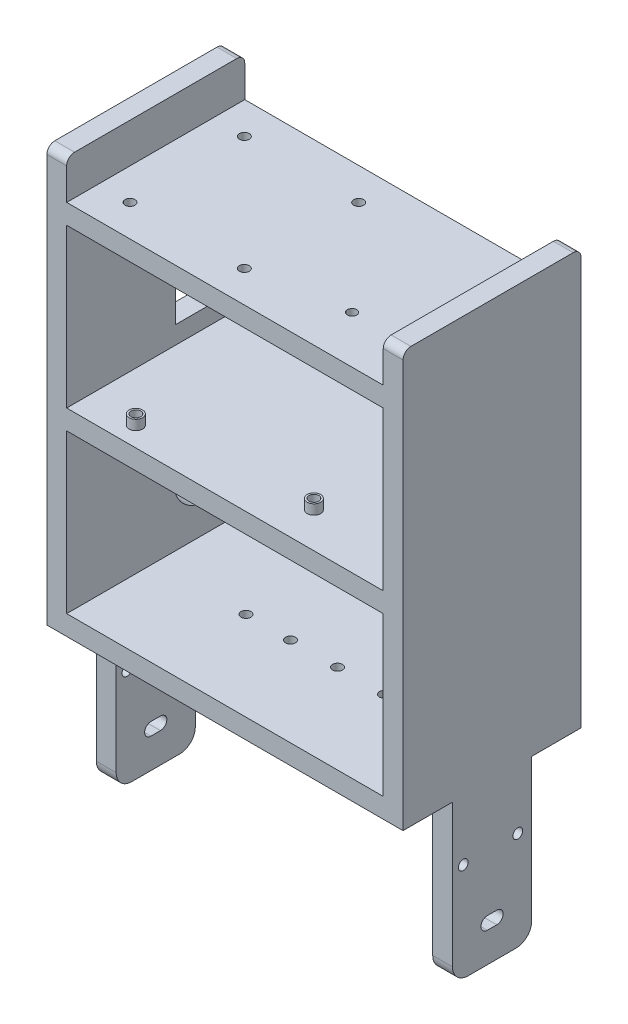
from build123d import *
from build123d.topology import SkipClean

# Parameters (mm, degrees)
SKETCH1_W             = 6.35
SKETCH1_H             = 127
SKETCH1_W_2           = 101.6
SKETCH1_H_2           = 6.35
BOSS_EXTRUDE1_DEPTH   = 57.15
SKETCH2_W             = 25.4
SKETCH2_H             = 50.8
BOSS_EXTRUDE2_DEPTH   = 6.35
BOSS_EXTRUDE3_DEPTH   = 0.508
CUT_EXTRUDE1_DEPTH    = 181.488225001
FILLET1_R             = 5.00126
SKETCH7_R             = 1.5748
CUT_EXTRUDE2_DEPTH    = 181.165514181
CUT_EXTRUDE3_DEPTH    = 6.35
BOSS_EXTRUDE6_START   = 3.81
BOSS_EXTRUDE6_DEPTH   = 3.81
SKETCH10_R            = 1.5875
CUT_EXTRUDE5_DEPTH    = 6.35
SKETCH11_R            = 1.5875
CUT_EXTRUDE6_DEPTH    = 6.35
SKETCH12_R            = 1.49987
CUT_EXTRUDE7_DEPTH    = 6.35
SKETCH13_R            = 1.5875
CUT_EXTRUDE8_DEPTH    = 6.35
SKETCH9_W             = 12.7
SKETCH9_H             = 10.922
CUT_EXTRUDE4_DEPTH    = 6.35
SKETCH10_5_R          = 2.159
SKETCH10_5_R_2        = 1.5875
BOSS_EXTRUDE9_DEPTH   = 3.175
BOSS_EXTRUDE9_2_DEPTH = 3.175
BOSS_EXTRUDE9_3_DEPTH = 3.175
BOSS_EXTRUDE9_4_DEPTH = 3.175
FILLET2_R             = 2.54


with BuildPart() as part:
    # Sketch1 → Boss-Extrude1 (new body)
    with BuildSketch(Plane.XY):
        with Locations((104.775, 63.5)):
            Rectangle(SKETCH1_W, SKETCH1_H)
        with Locations((-3.175, 63.5)):
            Rectangle(SKETCH1_W, SKETCH1_H)
        with Locations((50.8, 111.125)):
            Rectangle(SKETCH1_W_2, SKETCH1_H_2)
        with Locations((50.8, 53.975)):
            Rectangle(SKETCH1_W_2, SKETCH1_H_2)
        Polygon((107.95, -6.35), (101.6, -6.35), (0, -6.35), (-6.35, -6.35), (-6.35, 0), (0, 0), (101.6, 0), (107.95, 0), align=None)
    extrude(amount=-BOSS_EXTRUDE1_DEPTH)

    # Sketch2 → Boss-Extrude2 (add)
    with BuildSketch(Plane(origin=(107.95, 0, 0), x_dir=(0, 0, -1), z_dir=(1, 0, 0))):
        with Locations((28.575, -31.75)):
            Rectangle(SKETCH2_W, SKETCH2_H)
    boss_extrude2 = extrude(amount=-BOSS_EXTRUDE2_DEPTH)

    # Mirror1: Boss-Extrude2 across plane
    add(boss_extrude2.mirror(Plane(origin=(50.8, 0, 0), x_dir=(0, 0, 1), z_dir=(1, 0, 0))))

    # Sketch4 → Boss-Extrude3 (add)
    with BuildSketch(Plane.ZY.offset(6.35)):
        Polygon((-28.657476896, 66.071615527), (-28.737119471, 75.236068065), (-27.523959323, 75.247180983), (-27.453577513, 67.164385737), (-22.939880901, 67.203280948), (-22.930620136, 66.121623655), align=None)
        Polygon((-28.44342412, 49.573585988), (-28.523066695, 58.738038526), (-21.897915779, 58.795455265), (-21.888655015, 57.713797973), (-27.300645782, 57.665641998), (-27.276567795, 54.859630358), (-22.207225313, 54.904082027), (-22.197964549, 53.827981194), (-27.26730703, 53.783529524), (-27.239524737, 50.664504044), (-21.614536386, 50.714512173), (-21.605275622, 49.63285488), align=None)
        Polygon((-28.29340319, 31.651300701), (-28.373045764, 40.815753239), (-21.747894849, 40.873169979), (-21.738634085, 39.791512686), (-27.150624852, 39.743356711), (-27.126546864, 36.937345071), (-22.057204383, 36.981796741), (-22.047943619, 35.905695907), (-27.1172861, 35.861244237), (-27.089503806, 32.742218758), (-21.464515456, 32.792226886), (-21.455254691, 31.710569593), align=None)
        Polygon((-28.219320528, 13.727163261), (-28.298963103, 22.891615799), (-27.085802955, 22.902728717), (-27.046907744, 18.357545506), (-22.535063285, 22.941623927), (-20.890351512, 22.956441151), (-24.703934328, 19.209535839), (-20.642163024, 13.793840765), (-22.242423127, 13.779023542), (-25.546663897, 18.389032105), (-27.033942674, 16.914718398), (-27.00616038, 13.738276179), align=None)
    extrude(amount=BOSS_EXTRUDE3_DEPTH)

    # Sketch5 → Cut-Extrude1 (cut, through all)
    with BuildSketch(Plane(origin=(107.95, 0, 0), x_dir=(0, 0, -1), z_dir=(1, 0, 0))):
        with BuildLine():
            Line((27.051, -43.49496), (30.099, -43.49496))
            ThreePointArc((30.099, -43.49496), (32.131, -45.52696), (30.099, -47.55896))
            Line((30.099, -47.55896), (27.051, -47.55896))
            ThreePointArc((27.051, -47.55896), (25.019, -45.52696), (27.051, -43.49496))
        make_face()
    extrude(amount=-CUT_EXTRUDE1_DEPTH, mode=Mode.SUBTRACT)

    # Fillet1
    fillet1_edges = [part.edges().sort_by_distance(p)[0] for p in [
        (104.775, -57.15, -41.275),
        (104.775, -57.15, -15.875),
        (-3.175, -57.15, -15.875),
        (-3.175, -57.15, -41.275),
    ]]
    fillet(fillet1_edges, radius=FILLET1_R)

    # Sketch7 → Cut-Extrude2 (cut, through all)
    with BuildSketch(Plane.ZY.offset(6.35)):
        with Locations((-36.83508, -25.527)):
            Circle(SKETCH7_R)
        with Locations((-19.33448, -25.527)):
            Circle(SKETCH7_R)
    extrude(amount=-CUT_EXTRUDE2_DEPTH, mode=Mode.SUBTRACT)

    # Sketch8 → Cut-Extrude3 (cut)
    with BuildSketch(Plane.ZY.offset(6.35)):
        with BuildLine():
            ThreePointArc((-34.665970856, 21.27123), (-44.45, 29.083), (-54.234029144, 21.27123))
            Line((-54.234029144, 21.27123), (-34.665970856, 21.27123))
        make_face()
        with BuildLine():
            Line((-34.665970856, 21.27123), (-54.234029144, 21.27123))
            ThreePointArc((-54.234029144, 21.27123), (-54.483, 19.05), (-54.234029144, 16.82877))
            Line((-54.234029144, 16.82877), (-34.665970856, 16.82877))
            ThreePointArc((-34.665970856, 16.82877), (-34.479436992, 17.932430181), (-34.417, 19.05))
            ThreePointArc((-34.417, 19.05), (-34.479436992, 20.167569819), (-34.665970856, 21.27123))
        make_face()
        with BuildLine():
            Line((-34.665970856, 16.82877), (-54.234029144, 16.82877))
            ThreePointArc((-54.234029144, 16.82877), (-44.45, 9.017), (-34.665970856, 16.82877))
        make_face()
    extrude(amount=-CUT_EXTRUDE3_DEPTH, mode=Mode.SUBTRACT)

    # Sketch8<3> → Boss-Extrude6 (add)
    with SkipClean():  # the faces are left unmerged after this step: merging them gives an invalid solid
        with BuildSketch(Plane.ZY.offset(6.35).offset(BOSS_EXTRUDE6_START)):
            with BuildLine():
                ThreePointArc((-33.108466317, 21.27123), (-44.45, 30.607), (-55.791533683, 21.27123))
                Line((-55.791533683, 21.27123), (-54.234029144, 21.27123))
                ThreePointArc((-54.234029144, 21.27123), (-44.45, 29.083), (-34.665970856, 21.27123))
                Line((-34.665970856, 21.27123), (-33.108466317, 21.27123))
            make_face()
            with BuildLine():
                Line((-54.234029144, 16.82877), (-55.791533683, 16.82877))
                ThreePointArc((-55.791533683, 16.82877), (-44.45, 7.493), (-33.108466317, 16.82877))
                Line((-33.108466317, 16.82877), (-34.665970856, 16.82877))
                ThreePointArc((-34.665970856, 16.82877), (-44.45, 9.017), (-54.234029144, 16.82877))
            make_face()
        extrude(amount=-BOSS_EXTRUDE6_DEPTH)

    # Sketch10 → Cut-Extrude5 (cut)
    with SkipClean():  # the faces are left unmerged after this step: merging them gives an invalid solid
        with BuildSketch(Plane(origin=(0, 57.15, 0), x_dir=(1, 0, 0), z_dir=(0, 1, 0))):
            with Locations(Location((15.875, 6.31698, 0), (0, 0, 270))):
                Circle(SKETCH10_R)
            with Locations(Location((67.945, 11.39698, 0), (0, 0, 270))):
                Circle(SKETCH10_R)
            with Locations(Location((67.945, 39.33698, 0), (0, 0, 270))):
                Circle(SKETCH10_R)
            with Locations(Location((17.145, 54.57698, 0), (0, 0, 270))):
                Circle(SKETCH10_R)
        extrude(amount=-CUT_EXTRUDE5_DEPTH, mode=Mode.SUBTRACT)

    # Sketch11 → Cut-Extrude6 (cut)
    with SkipClean():  # the faces are left unmerged after this step: merging them gives an invalid solid
        with BuildSketch(Plane(origin=(0, 114.3, 0), x_dir=(1, 0, 0), z_dir=(0, 1, 0))):
            with Locations(Location((10.16, 10.16, 0), (0, 0, 270))):
                Circle(SKETCH11_R)
            with Locations(Location((46.86046, 10.16, 0), (0, 0, 270))):
                Circle(SKETCH11_R)
            with Locations(Location((46.86046, 46.86046, 0), (0, 0, 270))):
                Circle(SKETCH11_R)
            with Locations(Location((10.16, 46.86046, 0), (0, 0, 270))):
                Circle(SKETCH11_R)
        extrude(amount=-CUT_EXTRUDE6_DEPTH, mode=Mode.SUBTRACT)

    # Sketch12 → Cut-Extrude7 (cut)
    with SkipClean():  # the faces are left unmerged after this step: merging them gives an invalid solid
        with BuildSketch(Plane(origin=(0, 114.3, 0), x_dir=(1, 0, 0), z_dir=(0, 1, 0))):
            with Locations(Location((91.345643218, 15.24, 0), (0, 0, 270))):
                Circle(SKETCH12_R)
            with Locations(Location((76.344403218, 15.24, 0), (0, 0, 270))):
                Circle(SKETCH12_R)
        extrude(amount=-CUT_EXTRUDE7_DEPTH, mode=Mode.SUBTRACT)

    # Sketch13 → Cut-Extrude8 (cut)
    with SkipClean():  # the faces are left unmerged after this step: merging them gives an invalid solid
        with BuildSketch(Plane(origin=(0, 0, 0), x_dir=(1, 0, 0), z_dir=(0, 1, 0))):
            with Locations(Location((58.3438, 28.575, 0), (0, 0, 270))):
                Circle(SKETCH13_R)
            with Locations(Location((43.2562, 28.575, 0), (0, 0, 270))):
                Circle(SKETCH13_R)
            with Locations(Location((73.4314, 28.575, 0), (0, 0, 270))):
                Circle(SKETCH13_R)
            with Locations(Location((28.9814, 28.575, 0), (0, 0, 270))):
                Circle(SKETCH13_R)
        extrude(amount=-CUT_EXTRUDE8_DEPTH, mode=Mode.SUBTRACT)

    # Sketch9 → Cut-Extrude4 (cut)
    with SkipClean():  # the faces are left unmerged after this step: merging them gives an invalid solid
        with BuildSketch(Plane.ZY.offset(6.35)):
            with Locations((-41.23944, 68.326)):
                Rectangle(SKETCH9_W, SKETCH9_H)
        extrude(amount=-CUT_EXTRUDE4_DEPTH, mode=Mode.SUBTRACT)

    # Fillet2
    fillet2_edges = [part.edges().sort_by_distance(p)[0] for p in [
        (104.775, 127, 0),
        (-3.175, 127, 0),
        (104.775, 127, -57.15),
        (-3.175, 127, -57.15),
    ]]
    fillet(fillet2_edges, radius=FILLET2_R)


with BuildPart() as body_2:
    # Sketch10<5> → Boss-Extrude9 (new body)
    with BuildSketch(Plane(origin=(0, 57.15, 0), x_dir=(1, 0, 0), z_dir=(0, 1, 0))):
        with Locations(Location((15.875, 6.31698, 0), (0, 0, 270))):
            Circle(SKETCH10_5_R)
        with Locations(Location((15.875, 6.31698, 0), (0, 0, 270))):
            Circle(SKETCH10_5_R_2, mode=Mode.SUBTRACT)
    extrude(amount=BOSS_EXTRUDE9_DEPTH)


with BuildPart() as body_3:
    # Sketch10<5> → Boss-Extrude9 2 (new body)
    with BuildSketch(Plane(origin=(0, 57.15, 0), x_dir=(1, 0, 0), z_dir=(0, 1, 0))):
        with Locations(Location((67.945, 11.39698, 0), (0, 0, 270))):
            Circle(SKETCH10_5_R)
        with Locations(Location((67.945, 11.39698, 0), (0, 0, 270))):
            Circle(SKETCH10_5_R_2, mode=Mode.SUBTRACT)
    extrude(amount=BOSS_EXTRUDE9_2_DEPTH)


with BuildPart() as body_4:
    # Sketch10<5> → Boss-Extrude9 3 (new body)
    with BuildSketch(Plane(origin=(0, 57.15, 0), x_dir=(1, 0, 0), z_dir=(0, 1, 0))):
        with Locations(Location((67.945, 39.33698, 0), (0, 0, 270))):
            Circle(SKETCH10_5_R)
        with Locations(Location((67.945, 39.33698, 0), (0, 0, 270))):
            Circle(SKETCH10_5_R_2, mode=Mode.SUBTRACT)
    extrude(amount=BOSS_EXTRUDE9_3_DEPTH)


with BuildPart() as body_5:
    # Sketch10<5> → Boss-Extrude9 4 (new body)
    with BuildSketch(Plane(origin=(0, 57.15, 0), x_dir=(1, 0, 0), z_dir=(0, 1, 0))):
        with Locations(Location((17.145, 54.57698, 0), (0, 0, 270))):
            Circle(SKETCH10_5_R)
        with Locations(Location((17.145, 54.57698, 0), (0, 0, 270))):
            Circle(SKETCH10_5_R_2, mode=Mode.SUBTRACT)
    extrude(amount=BOSS_EXTRUDE9_4_DEPTH)


solid = Compound([part.part, body_2.part, body_3.part, body_4.part, body_5.part])
